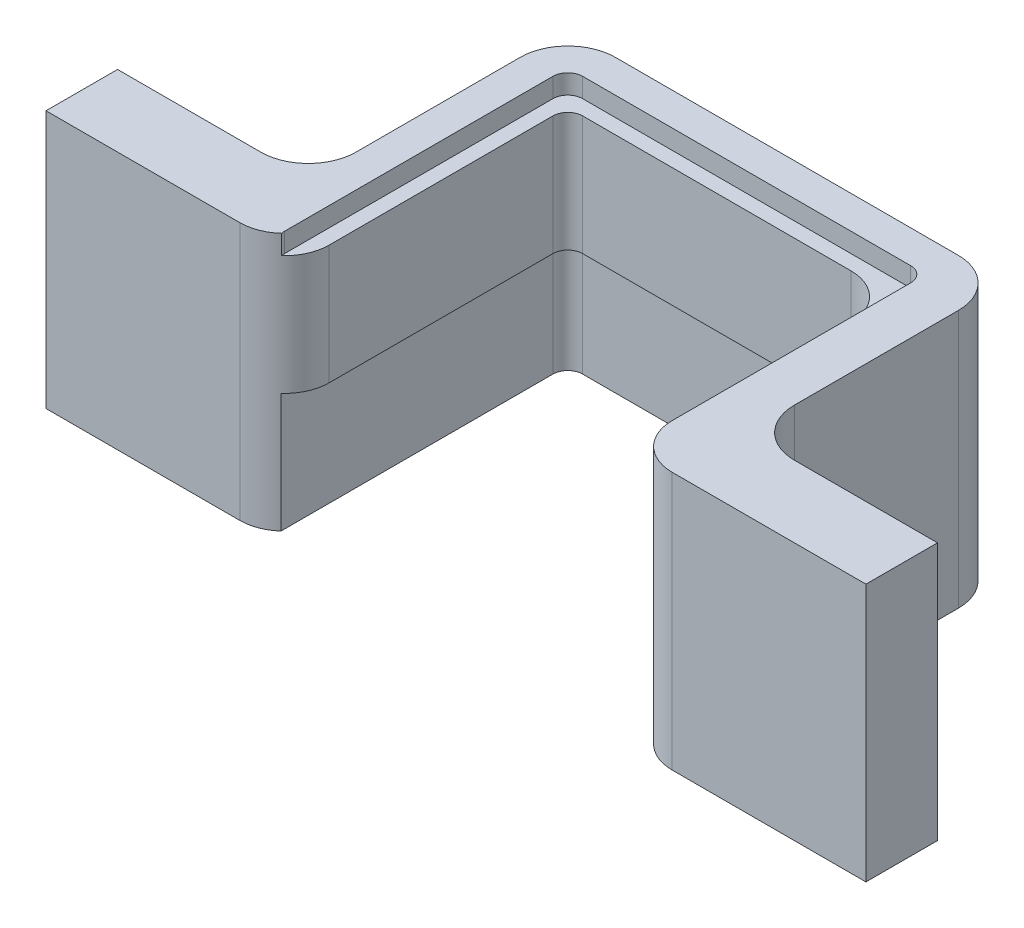
from build123d import *

# Parameters (mm, degrees)
BOSS_EXTRUDE1_DEPTH = 4
BOSS_EXTRUDE2_DEPTH = 0.65
BOSS_EXTRUDE3_START = 4
BOSS_EXTRUDE3_DEPTH = 4


with BuildPart() as part:
    # Sketch1 → Boss-Extrude1 (new body)
    with BuildSketch(Plane(origin=(0, 0, 0), x_dir=(1, 0, 0), z_dir=(0, 1, 0))):
        with BuildLine():
            Line((-5.5, -3.002039615), (-5.5, 4))
            ThreePointArc((-5.5, 4), (-5.353553391, 4.353553391), (-5, 4.5))
            Line((-5, 4.5), (4, 4.5))
            ThreePointArc((4, 4.5), (5.060660172, 4.060660172), (5.5, 3))
            Line((5.5, 3), (5.5, 1.5))
            Line((5.5, 1.5), (6, 1.5))
            Line((6, 1.5), (6, -3.5))
            ThreePointArc((6, -3.5), (6.439339828, -4.560660172), (7.5, -5))
            Line((7.5, -5), (14, -5))
            Line((14, -5), (14, -2.6))
            Line((14, -2.6), (9.2, -2.6))
            ThreePointArc((9.2, -2.6), (8.06862915, -2.13137085), (7.6, -1))
            Line((7.6, -1), (7.6, 4.5))
            ThreePointArc((7.6, 4.5), (7.13137085, 5.63137085), (6, 6.1))
            Line((6, 6.1), (-5.5, 6.1))
            ThreePointArc((-5.5, 6.1), (-6.63137085, 5.63137085), (-7.1, 4.5))
            Line((-7.1, 4.5), (-7.1, -1))
            ThreePointArc((-7.1, -1), (-7.56862915, -2.13137085), (-8.7, -2.6))
            Line((-8.7, -2.6), (-13.5, -2.6))
            Line((-13.5, -2.6), (-13.5, -5))
            Line((-13.5, -5), (-7, -5))
            ThreePointArc((-7, -5), (-5.939339828, -4.560660172), (-5.5, -3.5))
            Line((-5.5, -3.5), (-5.5, -3.002039615))
        make_face()
    extrude(amount=BOSS_EXTRUDE1_DEPTH)

    # Sketch2 → Boss-Extrude2 (add)
    with BuildSketch(Plane(origin=(0, 4, 0), x_dir=(1, 0, 0), z_dir=(0, 1, 0))):
        with BuildLine():
            Line((-13.5, -5), (-7, -5))
            ThreePointArc((-7, -5), (-6.457416135, -4.898428671), (-5.988313555, -4.607470332))
            ThreePointArc((-5.988313555, -4.607470332), (-5.997069803, -4.554051932), (-6, -4.5))
            Line((-6, -4.5), (-6, 4.5))
            ThreePointArc((-6, 4.5), (-5.853553391, 4.853553391), (-5.5, 5))
            Line((-5.5, 5), (5.5, 5))
            ThreePointArc((5.5, 5), (5.853553391, 4.853553391), (6, 4.5))
            Line((6, 4.5), (6, -3.5))
            ThreePointArc((6, -3.5), (6.439339828, -4.560660172), (7.5, -5))
            Line((7.5, -5), (14, -5))
            Line((14, -5), (14, -2.6))
            Line((14, -2.6), (9.2, -2.6))
            ThreePointArc((9.2, -2.6), (8.06862915, -2.13137085), (7.6, -1))
            Line((7.6, -1), (7.6, 4.5))
            ThreePointArc((7.6, 4.5), (7.13137085, 5.63137085), (6, 6.1))
            Line((6, 6.1), (-5.5, 6.1))
            ThreePointArc((-5.5, 6.1), (-6.63137085, 5.63137085), (-7.1, 4.5))
            Line((-7.1, 4.5), (-7.1, -1))
            ThreePointArc((-7.1, -1), (-7.56862915, -2.13137085), (-8.7, -2.6))
            Line((-8.7, -2.6), (-13.5, -2.6))
            Line((-13.5, -2.6), (-13.5, -5))
        make_face()
    extrude(amount=BOSS_EXTRUDE2_DEPTH)

    # Sketch3 → Boss-Extrude3 (add)
    with BuildSketch(Plane.XZ.offset(BOSS_EXTRUDE3_START)):
        with BuildLine():
            Line((7.6, -4.5), (7.6, 1))
            ThreePointArc((7.6, 1), (8.06862915, 2.13137085), (9.2, 2.6))
            Line((9.2, 2.6), (14, 2.6))
            Line((14, 2.6), (14, 5))
            Line((14, 5), (7.5, 5))
            ThreePointArc((7.5, 5), (6.439339828, 4.560660172), (6, 3.5))
            Line((6, 3.5), (6, 2.6))
            Line((6, 2.6), (6, -1.5))
            Line((6, -1.5), (6, -4.5))
            ThreePointArc((6, -4.5), (5.853553391, -4.853553391), (5.5, -5))
            Line((5.5, -5), (-5.5, -5))
            ThreePointArc((-5.5, -5), (-5.853553391, -4.853553391), (-6, -4.5))
            Line((-6, -4.5), (-6, 2.6))
            Line((-6, 2.6), (-6, 4.5))
            Line((-6, 4.5), (-6, 4.618033989))
            ThreePointArc((-6, 4.618033989), (-6.464766865, 4.901258538), (-7, 5))
            Line((-7, 5), (-13.5, 5))
            Line((-13.5, 5), (-13.5, 2.6))
            Line((-13.5, 2.6), (-8.7, 2.6))
            ThreePointArc((-8.7, 2.6), (-7.56862915, 2.13137085), (-7.1, 1))
            Line((-7.1, 1), (-7.1, -4.5))
            ThreePointArc((-7.1, -4.5), (-6.63137085, -5.63137085), (-5.5, -6.1))
            Line((-5.5, -6.1), (6, -6.1))
            ThreePointArc((6, -6.1), (7.13137085, -5.63137085), (7.6, -4.5))
        make_face()
    extrude(amount=-BOSS_EXTRUDE3_DEPTH)


solid = part.part
